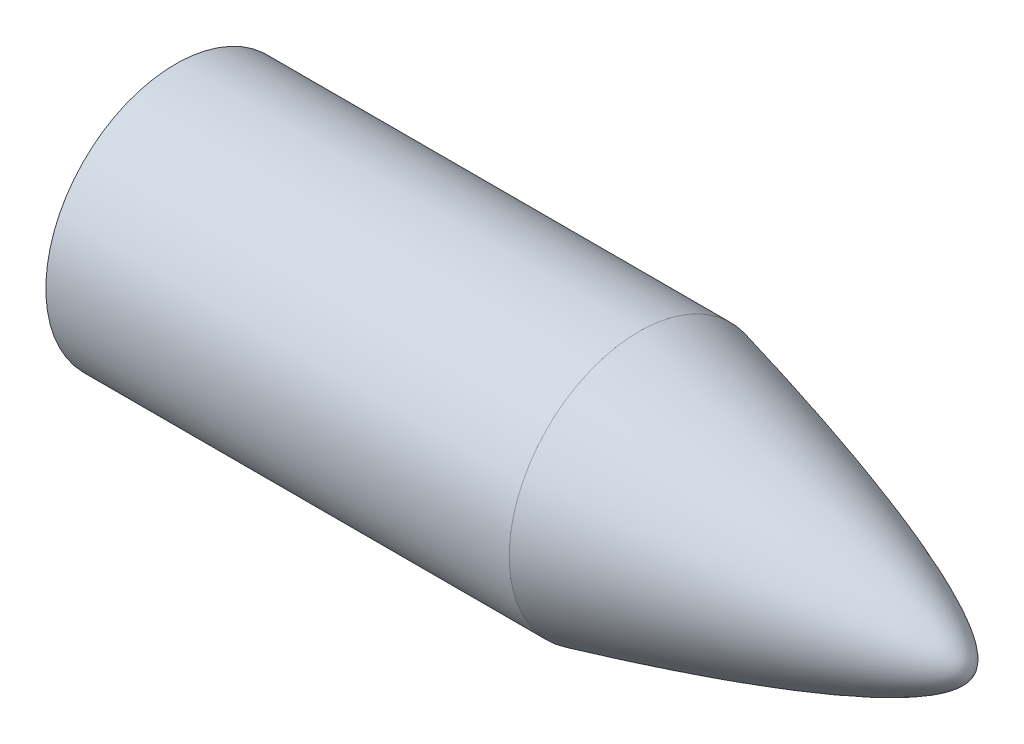
from build123d import *

# Parameters (mm, degrees)
SKETCH1_W = 175
SKETCH1_H = 49


with BuildPart() as part:
    # Sketch1 → Revolve4 (revolve)
    with BuildSketch(Plane(origin=(0, 0, 0), x_dir=(1, 0, 0), z_dir=(0, 1, 0))):
        with Locations((2.455932203, 24.5)):
            Rectangle(SKETCH1_W, SKETCH1_H)
        with BuildLine():
            add(Edge.make_bspline(
                [(214.955932203, 0), (217.855670645, 17.753500666), (89.955932203, 49)],
                knots=[0, 0, 0, 0.966509106, 0.966509106, 0.966509106], degree=2, weights=[1, 0.885487343, 1]))
            Line((89.955932203, 49), (89.955932203, 0))
            Line((89.955932203, 0), (214.955932203, 0))
        make_face()
    revolve(axis=Axis((132.80147706, 0, 0), (-1, 0, 0)))


solid = part.part
